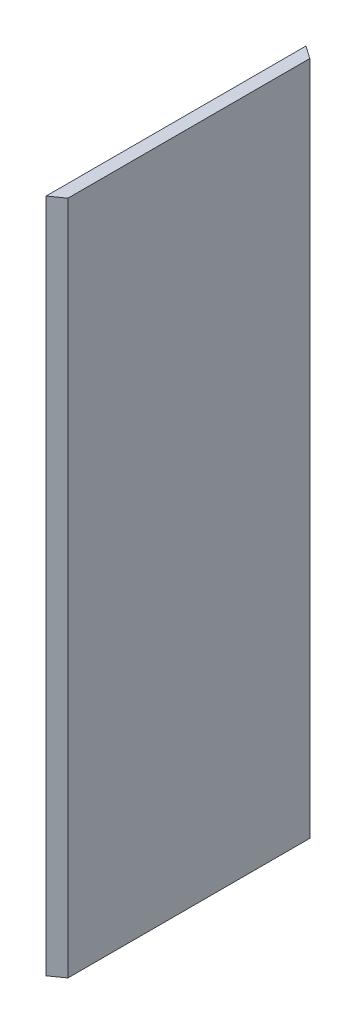
from build123d import *

# Parameters (mm, degrees)
BOSS_EXTRUDE1_DEPTH = 13


with BuildPart() as part:
    # Sketch1 → Boss-Extrude1 (new body)
    with BuildSketch(Plane(origin=(0, 0, 0), x_dir=(1, 0, 0), z_dir=(0, 1, 0))):
        Polygon((0, 0), (0, 5), (0.245745613, 4.827927069), (0.245745613, 0.172072931), align=None)
    extrude(amount=BOSS_EXTRUDE1_DEPTH)


solid = part.part
